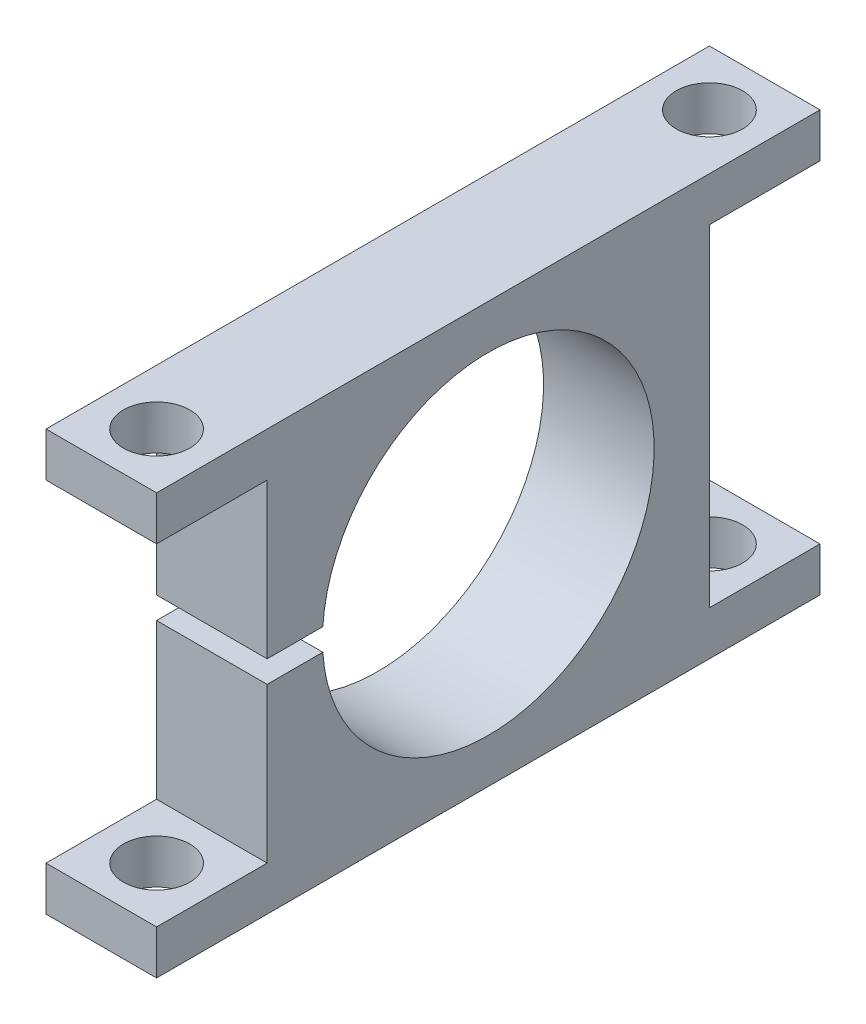
from build123d import *

# Parameters (mm, degrees)
SKETCH_1_W           = 20
SKETCH_1_H           = 19
SKETCH_1_R           = 7.5
EXTRUDE_3_DEPTH      = 5
EXTRUDE_4_DEPTH      = 0.0001
EXTRUDE_4_DEPTH_BACK = 5
SKETCH_3_W           = 5
SKETCH_3_H           = 2
SKETCH_4_R           = 1.5
CUT_EXTRUDE_1_DEPTH  = 25.718414189
SKETCH_5_R           = 1.5
CUT_EXTRUDE_2_DEPTH  = 25.718414189
SKETCH_6_W           = 5.334039958
SKETCH_6_H           = 1
CUT_EXTRUDE_3_DEPTH  = 19.445893852


with BuildPart() as part:
    # 草图1 → 凸台-拉伸3 (new body)
    with BuildSketch(Plane(origin=(0, 0, 0), x_dir=(0, 0, -1), z_dir=(1, 0, 0))):
        Rectangle(SKETCH_1_W, SKETCH_1_H)
        Circle(SKETCH_1_R, mode=Mode.SUBTRACT)
    extrude(amount=EXTRUDE_3_DEPTH)

    # 草图3 → 凸台-拉伸4 (add, two sides: drawn at the far end of the back side and taken through both)
    with BuildSketch(Plane.ZY.offset(-EXTRUDE_4_DEPTH_BACK)):
        with Locations((12.5, 8.5)):
            Rectangle(SKETCH_3_W, SKETCH_3_H)
        with Locations((12.5, -8.5)):
            Rectangle(SKETCH_3_W, SKETCH_3_H)
        with Locations((-12.5, 8.5)):
            Rectangle(SKETCH_3_W, SKETCH_3_H)
        with Locations((-12.5, -8.5)):
            Rectangle(SKETCH_3_W, SKETCH_3_H)
    extrude(amount=EXTRUDE_4_DEPTH + EXTRUDE_4_DEPTH_BACK)

    # 草图4 → 切除-拉伸1 (cut, through all)
    with BuildSketch(Plane(origin=(0, 9.5, 0), x_dir=(1, 0, 0), z_dir=(0, 1, 0))):
        with Locations(Location((2.49995, -12.5, 0), (0, 0, 270))):
            Circle(SKETCH_4_R)
    extrude(amount=-CUT_EXTRUDE_1_DEPTH, mode=Mode.SUBTRACT)

    # 草图5 → 切除-拉伸2 (cut, through all)
    with BuildSketch(Plane(origin=(0, 9.5, 0), x_dir=(1, 0, 0), z_dir=(0, 1, 0))):
        with Locations(Location((2.49995, 12.5, 0), (0, 0, 270))):
            Circle(SKETCH_5_R)
    extrude(amount=-CUT_EXTRUDE_2_DEPTH, mode=Mode.SUBTRACT)

    # 草图6 → 切除-拉伸3 (cut, through all)
    with BuildSketch(Plane(origin=(5, 0, 0), x_dir=(0, 0, -1), z_dir=(1, 0, 0))):
        with Locations((-7.5, 0)):
            Rectangle(SKETCH_6_W, SKETCH_6_H)
    extrude(amount=-CUT_EXTRUDE_3_DEPTH, mode=Mode.SUBTRACT)


solid = part.part
